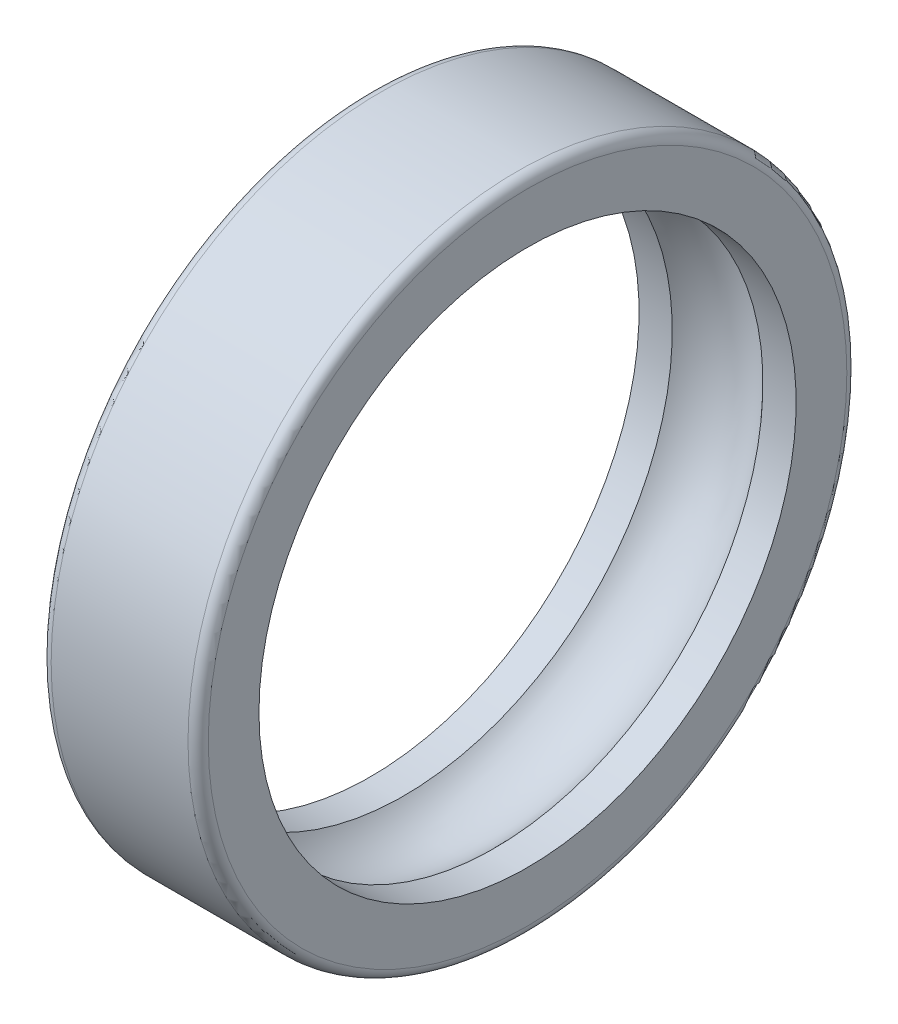
from build123d import *

# Parameters (mm, degrees)
FILLET_1_R = 2


with BuildPart() as part:
    # 草图1 → 旋转1 (revolve)
    with BuildSketch(Plane.XY, mode=Mode.PRIVATE) as revolve_1_sk:
        with BuildLine():
            Line((-15.5, 53), (-8.94427191, 53))
            ThreePointArc((-8.94427191, 53), (0, 57), (8.94427191, 53))
            Line((8.94427191, 53), (15.5, 53))
            Line((15.5, 53), (15.5, 65))
            Line((15.5, 65), (-15.5, 65))
            Line((-15.5, 65), (-15.5, 53))
        make_face()
    revolve(revolve_1_sk.sketch.rotate(Axis((0, 0, 0), (1, 0, 0)), 90), axis=Axis((0, 0, 0), (1, 0, 0)))

    # 圆角1
    fillet_1_edges = [part.edges().sort_by_distance(p)[0] for p in [
        (15.5, 0, -65),
        (-15.5, 0, -65),
    ]]
    fillet(fillet_1_edges, radius=FILLET_1_R)


solid = part.part
